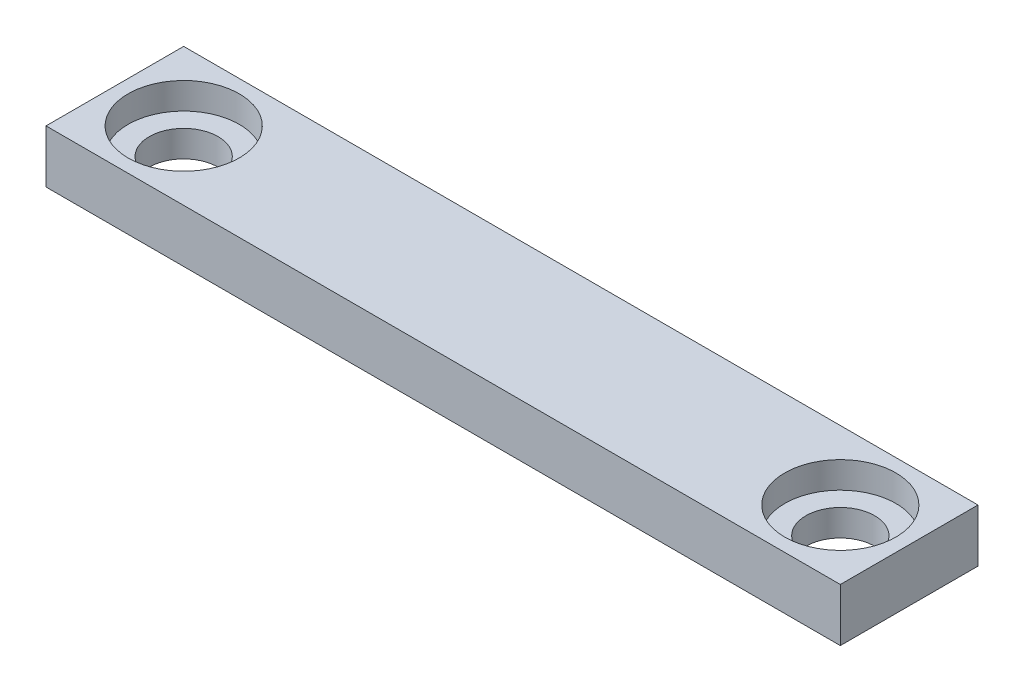
from build123d import *

# Parameters (mm, degrees)
SKETCH1_W                                           = 19.05
SKETCH1_H                                           = 3.302
BOSS_EXTRUDE1_DEPTH                                 = 1.27
CBORE_FOR_00_BINDING_HEAD_MACHINE_SCREW_D           = 1.651
CBORE_FOR_00_BINDING_HEAD_MACHINE_SCREW_CBORE_D     = 2.667
CBORE_FOR_00_BINDING_HEAD_MACHINE_SCREW_CBORE_DEPTH = 0.635


with BuildPart() as part:
    # Sketch1 → Boss-Extrude1 (new body)
    with BuildSketch(Plane(origin=(0, 0, 0), x_dir=(1, 0, 0), z_dir=(0, 1, 0))):
        with Locations((9.525, 1.651)):
            Rectangle(SKETCH1_W, SKETCH1_H)
    extrude(amount=BOSS_EXTRUDE1_DEPTH)

    # CBORE for #00 Binding Head Machine Screw1 (through all)
    with Locations(Plane(origin=(0, 1.27, 0), x_dir=(1, 0, 0), z_dir=(0, 1, 0))):
        with Locations((1.651, 1.651)):
            cbore_for_00_binding_head_machine_screw = CounterBoreHole(CBORE_FOR_00_BINDING_HEAD_MACHINE_SCREW_D / 2, CBORE_FOR_00_BINDING_HEAD_MACHINE_SCREW_CBORE_D / 2, CBORE_FOR_00_BINDING_HEAD_MACHINE_SCREW_CBORE_DEPTH)

    # Mirror1: CBORE for #00 Binding Head Machine Screw1 across plane
    add(cbore_for_00_binding_head_machine_screw.mirror(Plane.ZY.offset(-9.525)), mode=Mode.SUBTRACT)


solid = part.part
